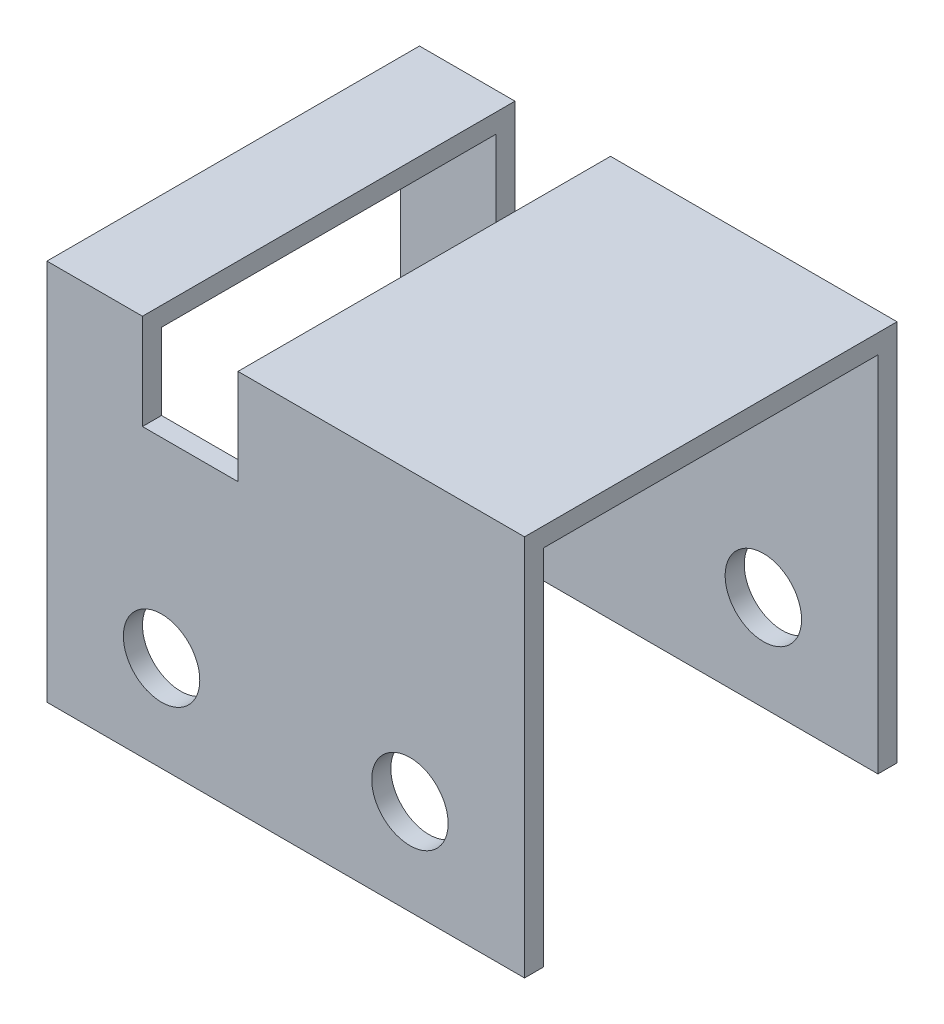
from build123d import *

# Parameters (mm, degrees)
HEAD_W_DEPTH        = 19.5
HEAD_T_W            = 35
HEAD_T_H            = 38
CUT_EXTRUDE_1_DEPTH = 66.186271561
SKETCH_3_R          = 4
CUT_EXTRUDE_2_DEPTH = 60.287435431


with BuildPart() as part:
    # ｽｹｯﾁ1 → Head-W (new, symmetric)
    with BuildSketch(Plane.XY):
        Polygon((-25, -37), (25, -37), (25, 3), (-5, 3), (-5, -7), (-15, -7), (-15, 3), (-25, 3), align=None)
    extrude(amount=HEAD_W_DEPTH, both=True)

    # Head-t → ｶｯﾄ - 押し出し1 (cut, through all)
    with BuildSketch(Plane(origin=(25, 0, 0), x_dir=(0, 0, -1), z_dir=(1, 0, 0))):
        with Locations((0, -18)):
            Rectangle(HEAD_T_W, HEAD_T_H)
    extrude(amount=-CUT_EXTRUDE_1_DEPTH, mode=Mode.SUBTRACT)

    # ｽｹｯﾁ3 → ｶｯﾄ - 押し出し2 (cut, through all)
    with BuildSketch(Plane.XY.offset(19.5)):
        with Locations((-13, -27)):
            Circle(SKETCH_3_R)
        with Locations((13, -27)):
            Circle(SKETCH_3_R)
    extrude(amount=-CUT_EXTRUDE_2_DEPTH, mode=Mode.SUBTRACT)


solid = part.part
